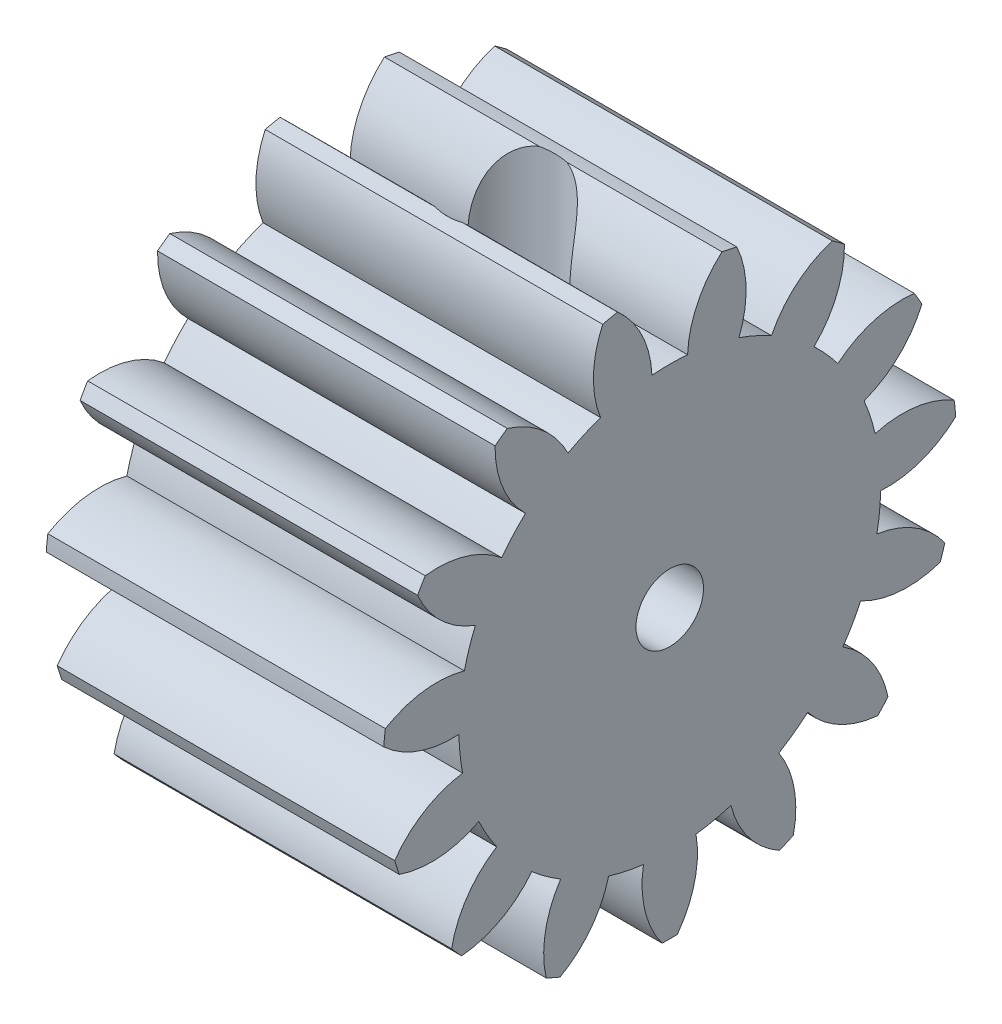
from build123d import *

# Parameters (mm, degrees)
BASPROSKE_W        = 15
BASPROSKE_H        = 12.75
TOOTHCUT_DEPTH     = 24.454743657
TEETHCUTS_COUNT    = 15
TEETHCUTS_ANGLE    = 336
BORSKE_R           = 1.5
BORE_DEPTH         = 50.0000508
SKETCH1_R          = 2.4
CUT_EXTRUDE1_DEPTH = 18


with BuildPart() as part:
    # BasProSke → Base-Revolve (revolve)
    with BuildSketch(Plane(origin=(0, 0, 0), x_dir=(1, 0, 0), z_dir=(0, 1, 0)), mode=Mode.PRIVATE) as base_revolve_sk:
        with Locations((7.5, 6.375)):
            Rectangle(BASPROSKE_W, BASPROSKE_H)
    revolve(base_revolve_sk.sketch.rotate(Axis((-10, 0, 0), (1, 0, 0)), 180), axis=Axis((-10, 0, 0), (1, 0, 0)))

    # TooCutSke → ToothCut (cut, through all)
    with BuildSketch(Plane(origin=(0, 0, 0), x_dir=(0, 0, -1), z_dir=(1, 0, 0))):
        with BuildLine():
            ThreePointArc((0.791546546, 9.340520867), (0, 9.374), (-0.791546546, 9.340520867))
            ThreePointArc((-0.791546546, 9.340520867), (-1.235070734, 11.110218102), (-2.344732916, 12.558386549))
            ThreePointArc((-2.344732916, 12.558386549), (0, 12.7754), (2.344732916, 12.558386549))
            ThreePointArc((2.344732916, 12.558386549), (1.235070734, 11.110218102), (0.791546546, 9.340520867))
        make_face()
    toothcut = extrude(amount=TOOTHCUT_DEPTH, mode=Mode.SUBTRACT)

    # TeethCuts: ToothCut ×15 about axis
    teethcuts_axis = Axis((-10, 0, 0), (1, 0, 0))
    for i in range(1, TEETHCUTS_COUNT):
        add(toothcut.rotate(teethcuts_axis, i * TEETHCUTS_ANGLE / (TEETHCUTS_COUNT - 1)), mode=Mode.SUBTRACT)

    # BorSke → Bore (cut, symmetric)
    with BuildSketch(Plane(origin=(0, 0, 0), x_dir=(0, 0, -1), z_dir=(1, 0, 0))):
        with Locations(Location((0, 0, 0), (0, 0, 180))):
            Circle(BORSKE_R)
    extrude(amount=BORE_DEPTH, both=True, mode=Mode.SUBTRACT)

    # Sketch1 → Cut-Extrude1 (cut)
    with BuildSketch(Plane(origin=(0, 0, 0), x_dir=(1, 0, 0), z_dir=(0, 1, 0))):
        with Locations(Location((7.5, 0, 0), (0, 0, 104.808618926))):
            Circle(SKETCH1_R)
    extrude(amount=CUT_EXTRUDE1_DEPTH, mode=Mode.SUBTRACT)


solid = part.part
